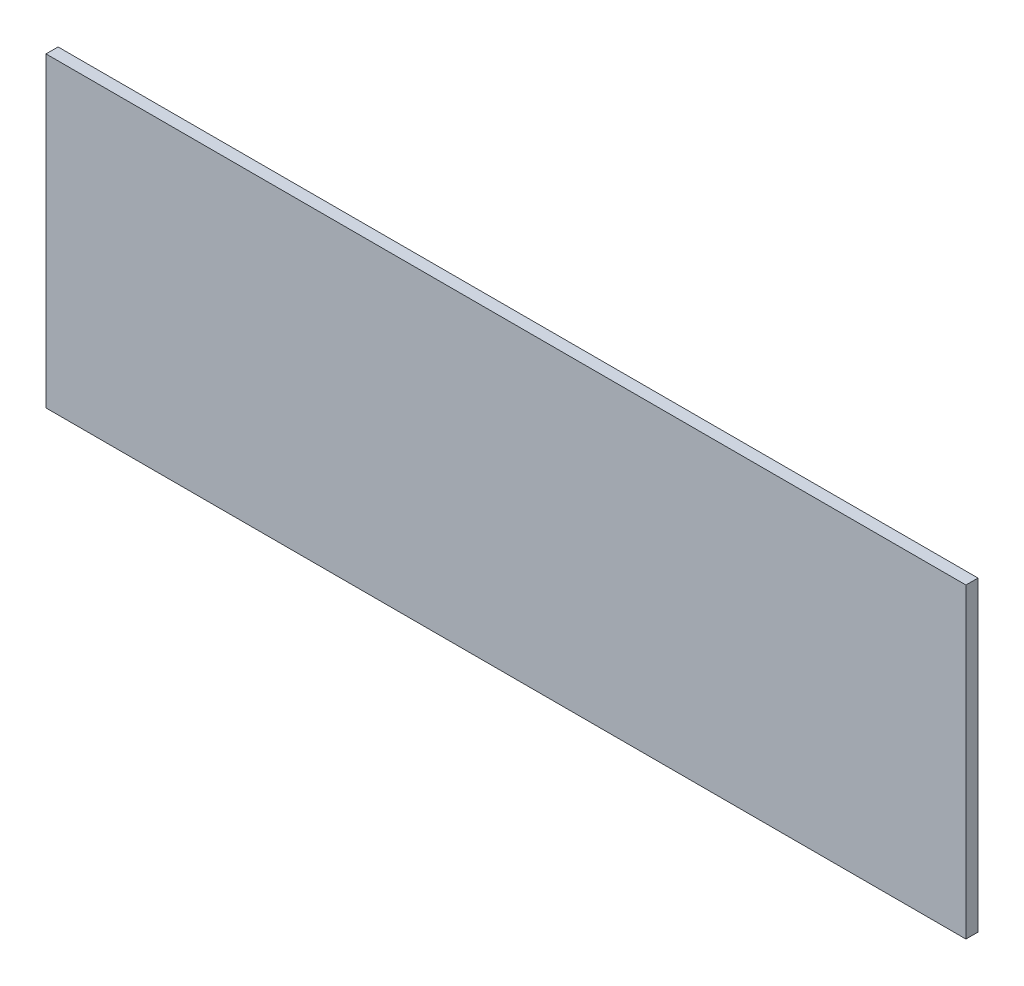
from build123d import *

# Parameters (mm, degrees)
SKETCH1_W           = 76.2
SKETCH1_H           = 25.4
BOSS_EXTRUDE1_DEPTH = 1


with BuildPart() as part:
    # Sketch1 → Boss-Extrude1 (new body)
    with BuildSketch(Plane.XY):
        with Locations((38.1, 12.7)):
            Rectangle(SKETCH1_W, SKETCH1_H)
    extrude(amount=BOSS_EXTRUDE1_DEPTH)


solid = part.part
